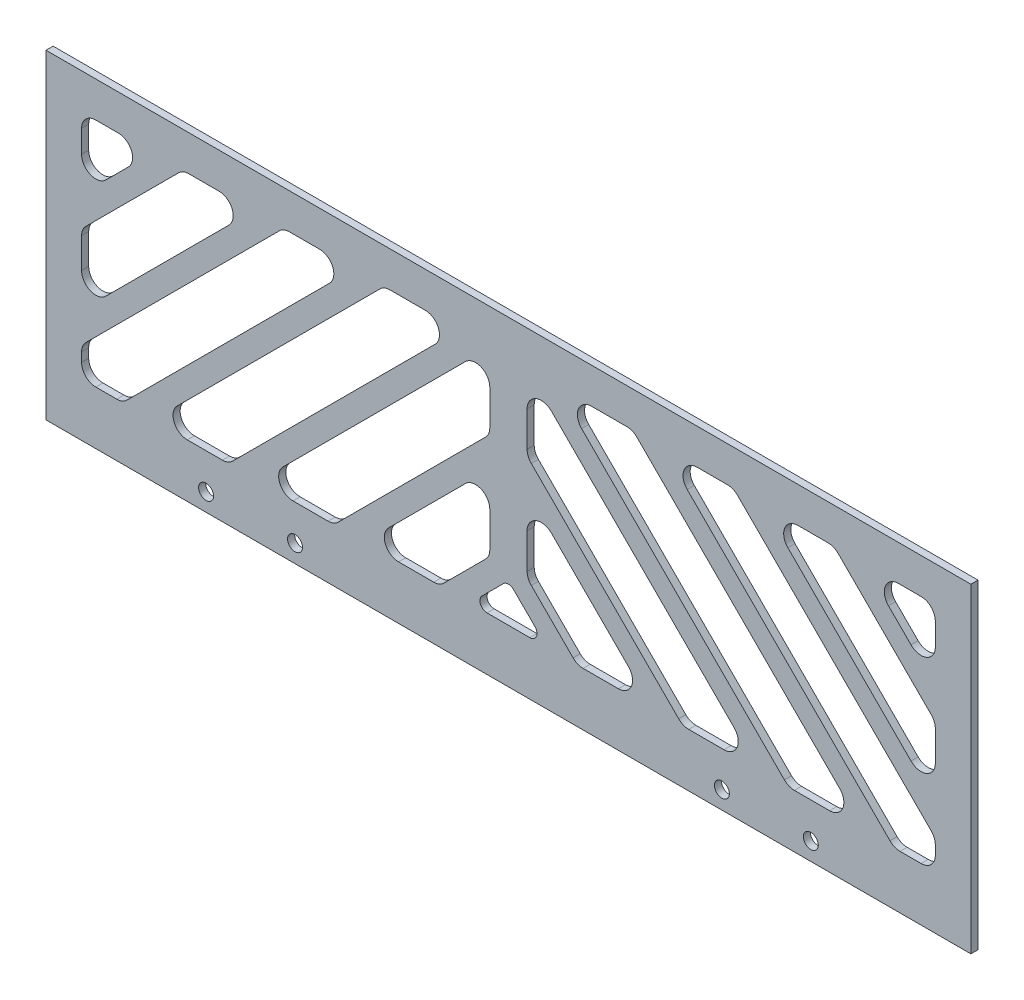
from build123d import *

# Parameters (mm, degrees)
SKETCH_1_W              = 260
SKETCH_1_H              = 90
EXTRUDE_1_DEPTH         = 2
HOLE_WIZARD_4_2_4_2_1_D = 4.2
CUT_EXTRUDE_1_DEPTH     = 159.126531613
FILLET_1_R              = 4
FILLET_1_OF_MIRROR_2_R  = 4
CUT_EXTRUDE_2_DEPTH     = 159.126531613


with BuildPart() as part:
    # 草图1 → 凸台-拉伸1 (new body)
    with BuildSketch(Plane.XY):
        with Locations((0, 45)):
            Rectangle(SKETCH_1_W, SKETCH_1_H)
    extrude(amount=EXTRUDE_1_DEPTH)

    # Ø4.2 (4.2) 直径孔1 (through all)
    with Locations(Plane(origin=(-60, 5, 2), x_dir=(1, 0, 0), z_dir=(0, 0, 1))):
        with Locations((0, 0), (-25, 0)):
            hole_wizard_4_2_4_2_1 = Hole(HOLE_WIZARD_4_2_4_2_1_D / 2)

    # 镜向1: Ø4.2 (4.2) 直径孔1 across plane
    add(hole_wizard_4_2_4_2_1.mirror(Plane(origin=(0, 0, 0), x_dir=(0, 0, 1), z_dir=(1, 0, 0))), mode=Mode.SUBTRACT)

    # 草图5 → 切除-拉伸1 (cut, through all)
    with BuildSketch(Plane.XY.offset(2)):
        Polygon((-120, 80), (-100, 80), (-120, 60), align=None)
        Polygon((-120, 15), (-108.431457505, 15), (-43.431457505, 80), (-63.230447378, 80), (-120, 23.230447378), align=None)
        Polygon((-5.247691321, 50.30151519), (-40.549206511, 15), (-19.336003076, 15), (-5.247691321, 29.088311755), align=None)
        Polygon((-91.514718626, 80), (-120, 51.514718626), (-120, 31.715728753), (-71.715728753, 80), align=None)
        Polygon((-34.946176131, 80), (-99.946176131, 15), (-78.732972695, 15), (-13.732972695, 80), align=None)
        Polygon((-5.247691321, 80), (-70.247691321, 15), (-49.034487885, 15), (-5.247691321, 58.786796564), align=None)
    cut_extrude_1 = extrude(amount=-CUT_EXTRUDE_1_DEPTH, mode=Mode.SUBTRACT)

    # 圆角1
    fillet_1_edges = [part.edges().sort_by_distance(p)[0] for p in [
        (-5.247691321, 80, 1),
        (-5.247691321, 58.786796564, 1),
        (-49.034487885, 15, 1),
        (-70.247691321, 15, 1),
        (-91.514718626, 80, 1),
        (-71.715728753, 80, 1),
        (-120, 31.715728753, 1),
        (-120, 51.514718626, 1),
        (-120, 15, 1),
        (-120, 23.230447378, 1),
        (-63.230447378, 80, 1),
        (-43.431457505, 80, 1),
        (-108.431457505, 15, 1),
        (-5.247691321, 50.30151519, 1),
        (-5.247691321, 29.088311755, 1),
        (-19.336003076, 15, 1),
        (-40.549206511, 15, 1),
        (-34.946176131, 80, 1),
        (-13.732972695, 80, 1),
        (-78.732972695, 15, 1),
        (-99.946176131, 15, 1),
        (-120, 60, 1),
        (-120, 80, 1),
        (-100, 80, 1),
    ]]
    fillet(fillet_1_edges, radius=FILLET_1_R)

    # 镜向2: 切除-拉伸1 across plane
    add(cut_extrude_1.mirror(Plane(origin=(0, 0, 0), x_dir=(0, 0, 1), z_dir=(1, 0, 0))), mode=Mode.SUBTRACT)

    # 圆角1 of 镜向2
    fillet_1_of_mirror_2_edges = [part.edges().sort_by_distance(p)[0] for p in [
        (5.247691321, 80, 1),
        (5.247691321, 58.786796564, 1),
        (49.034487885, 15, 1),
        (70.247691321, 15, 1),
        (91.514718626, 80, 1),
        (71.715728753, 80, 1),
        (120, 31.715728753, 1),
        (120, 51.514718626, 1),
        (120, 15, 1),
        (120, 23.230447378, 1),
        (63.230447378, 80, 1),
        (43.431457505, 80, 1),
        (108.431457505, 15, 1),
        (5.247691321, 50.30151519, 1),
        (5.247691321, 29.088311755, 1),
        (19.336003076, 15, 1),
        (40.549206511, 15, 1),
        (34.946176131, 80, 1),
        (13.732972695, 80, 1),
        (78.732972695, 15, 1),
        (99.946176131, 15, 1),
        (120, 60, 1),
        (120, 80, 1),
        (100, 80, 1),
    ]]
    fillet(fillet_1_of_mirror_2_edges, radius=FILLET_1_OF_MIRROR_2_R)

    # 草图6 → 切除-拉伸2 (cut, through all)
    with BuildSketch(Plane.XY.offset(2)):
        with BuildLine():
            Line((-1.414213562, 24.436508139), (-7.436508139, 18.414213562))
            ThreePointArc((-7.436508139, 18.414213562), (-7.870053642, 16.234633135), (-6.022294577, 15))
            Line((-6.022294577, 15), (6.022294577, 15))
            ThreePointArc((6.022294577, 15), (7.870053642, 16.234633135), (7.436508139, 18.414213562))
            Line((7.436508139, 18.414213562), (1.414213562, 24.436508139))
            ThreePointArc((1.414213562, 24.436508139), (0, 25.022294577), (-1.414213562, 24.436508139))
        make_face()
    extrude(amount=-CUT_EXTRUDE_2_DEPTH, mode=Mode.SUBTRACT)


solid = part.part
